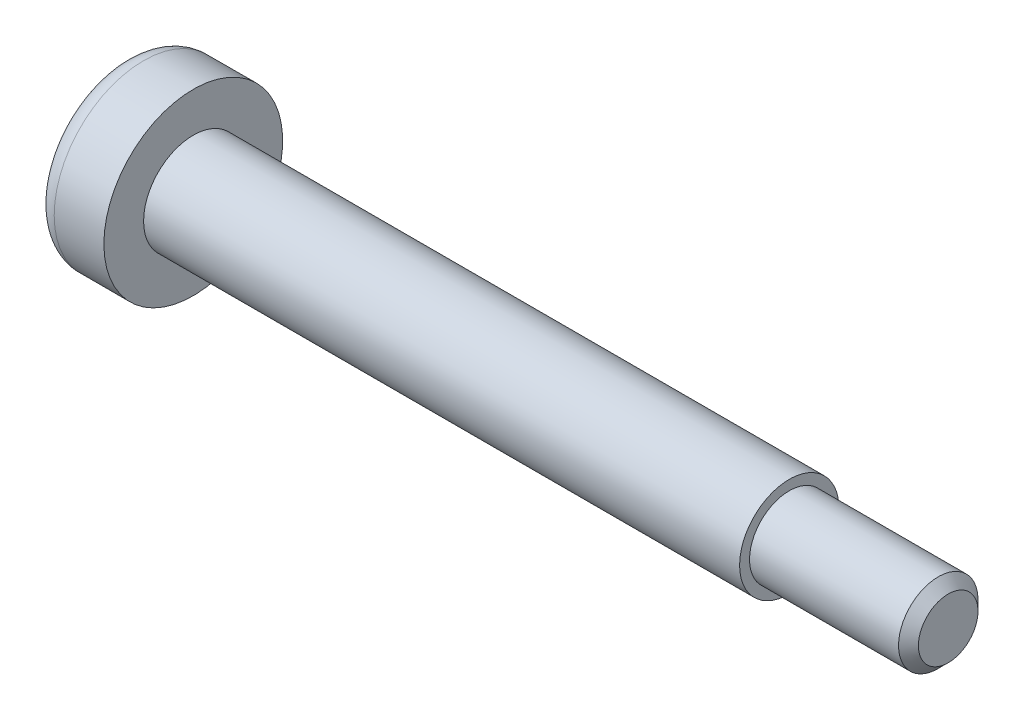
from build123d import *

# Parameters (mm, degrees)
CUT_EXTRUDE_1_DEPTH = 2.4
FILLET_1_R          = 1
CHAMFER_1_SIZE      = 0.5


with BuildPart() as part:
    # 草图1 → 旋转1 (revolve)
    with BuildSketch(Plane.XY, mode=Mode.PRIVATE) as revolve_1_sk:
        Polygon((0, 0), (0, 4.5), (3.5, 4.5), (3.5, 2.5), (33.5, 2.5), (33.5, 2), (41.5, 2), (41.5, 0), align=None)
    revolve(revolve_1_sk.sketch.rotate(Axis((0, 0, 0), (1, 0, 0)), 90), axis=Axis((0, 0, 0), (1, 0, 0)))

    # 草图2 → 切除-拉伸1 (cut)
    with BuildSketch(Plane.ZY):
        Polygon((0, 1.732050808), (-1.5, 0.866025404), (-1.5, -0.866025404), (0, -1.732050808), (1.5, -0.866025404), (1.5, 0.866025404), align=None)
    extrude(amount=-CUT_EXTRUDE_1_DEPTH, mode=Mode.SUBTRACT)

    # 圆角1
    fillet_1_edges = [part.edges().sort_by_distance(p)[0] for p in [
        (0, 0, -4.5),
    ]]
    fillet(fillet_1_edges, radius=FILLET_1_R)

    # 倒角1
    chamfer_1_edges = [part.edges().sort_by_distance(p)[0] for p in [
        (41.5, 0, -2),
    ]]
    chamfer(chamfer_1_edges, length=CHAMFER_1_SIZE)


solid = part.part
